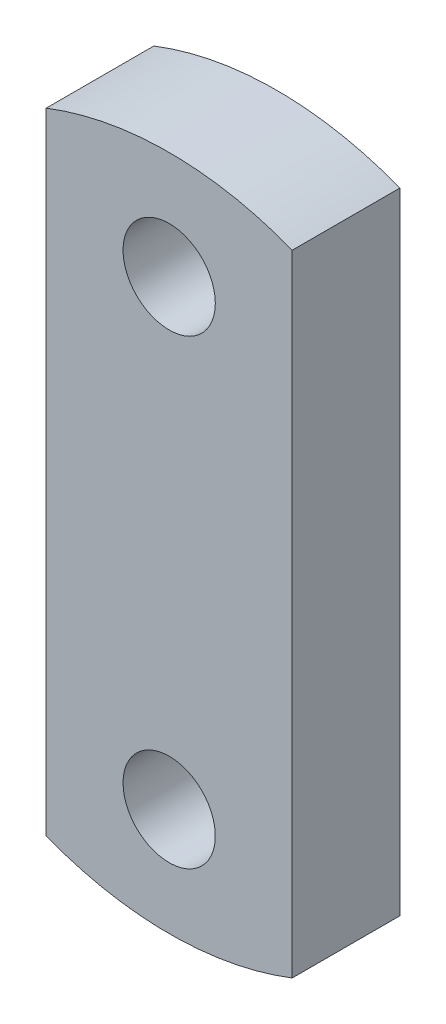
from build123d import *

# Parameters (mm, degrees)
SKETCH1_R           = 15
BOSS_EXTRUDE2_DEPTH = 35


with BuildPart() as part:
    # Sketch1 → Boss-Extrude2 (new body)
    with BuildSketch(Plane.XY):
        with BuildLine():
            Line((-40, 102.46950766), (-40, -102.46950766))
            ThreePointArc((-40, -102.46950766), (0, -110), (40, -102.46950766))
            Line((40, -102.46950766), (40, 102.46950766))
            ThreePointArc((40, 102.46950766), (0, 110), (-40, 102.46950766))
        make_face()
        with Locations((0, 75)):
            Circle(SKETCH1_R, mode=Mode.SUBTRACT)
        with Locations(Location((0, -75, 0), (0, 0, 180))):
            Circle(SKETCH1_R, mode=Mode.SUBTRACT)
    extrude(amount=BOSS_EXTRUDE2_DEPTH)


solid = part.part
